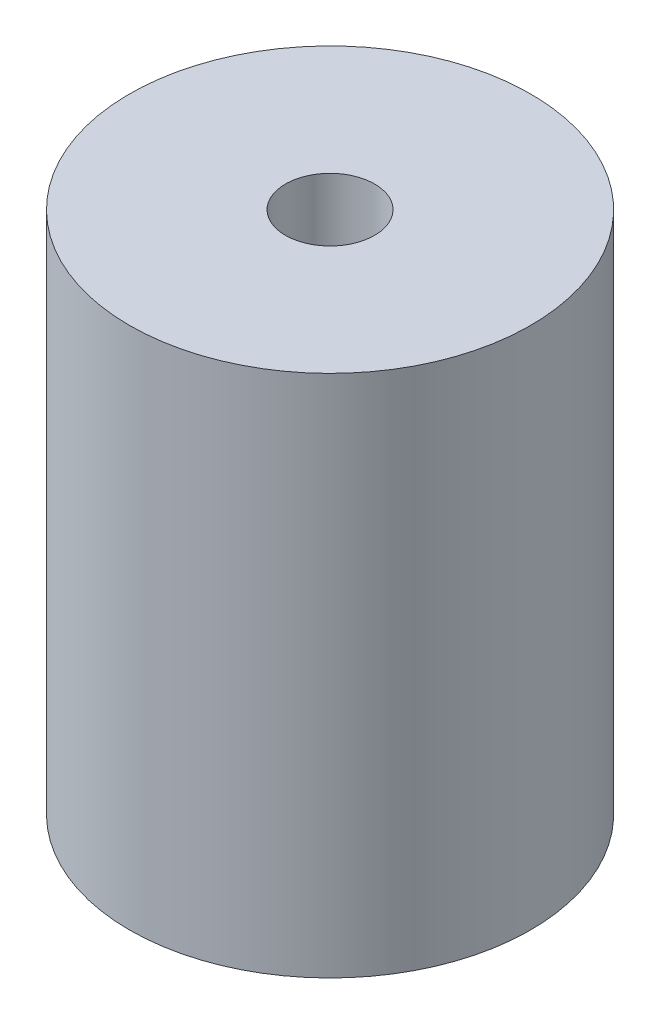
from build123d import *

# Parameters (mm, degrees)
SKETCH1_R           = 18
SKETCH1_R_2         = 4
BOSS_EXTRUDE1_DEPTH = 47


with BuildPart() as part:
    # Sketch1 → Boss-Extrude1 (new body)
    with BuildSketch(Plane(origin=(0, 0, 0), x_dir=(1, 0, 0), z_dir=(0, 1, 0))):
        with Locations(Location((0, 0, 0), (0, 0, 270))):
            Circle(SKETCH1_R)
        with Locations(Location((0, 0, 0), (0, 0, 270))):
            Circle(SKETCH1_R_2, mode=Mode.SUBTRACT)
    extrude(amount=-BOSS_EXTRUDE1_DEPTH)


solid = part.part
